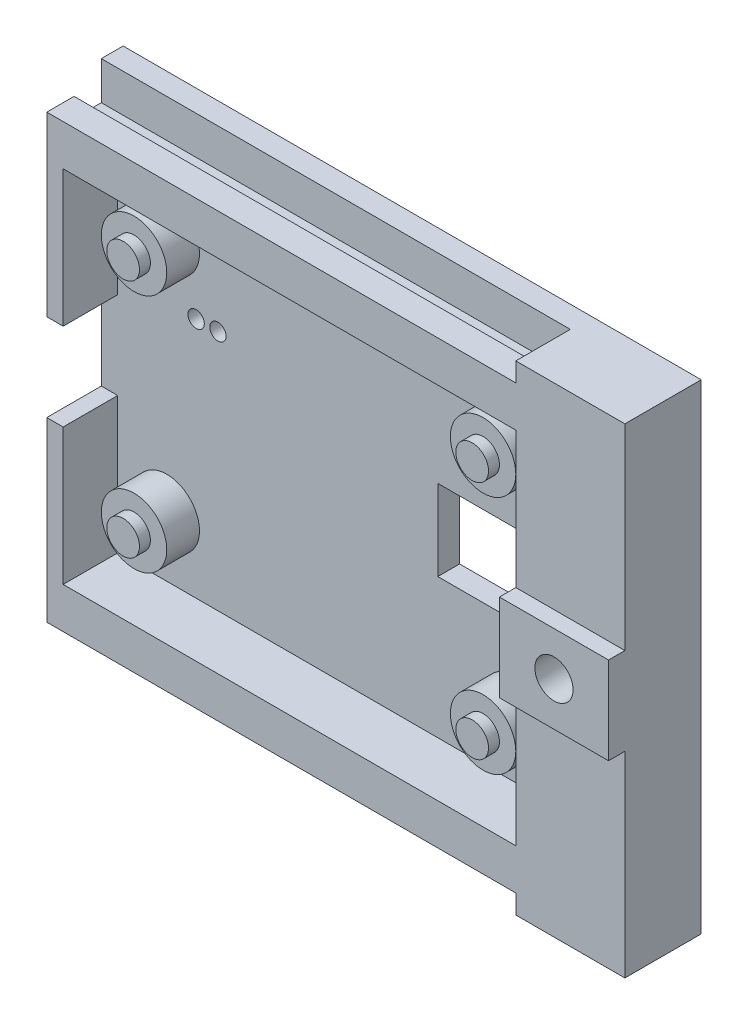
from build123d import *

# Parameters (mm, degrees)
CROQUIS1_W              = 53
CROQUIS1_H              = 44
CROQUIS1_R              = 0.75
CROQUIS1_W_2            = 7.4
CROQUIS1_H_2            = 7.4
SALIENTE_EXTRUIR1_DEPTH = 2
CROQUIS4_R              = 1.5
SALIENTE_EXTRUIR3_DEPTH = 4
CORTAR_EXTRUIR1_REACH   = 40.484
CROQUIS5_R              = 1.75
CROQUIS6_R              = 1.75
CROQUIS6_W              = 41.5
CROQUIS6_H              = 33
SALIENTE_EXTRUIR4_DEPTH = 5
CROQUIS7_W              = 43
CROQUIS7_H              = 1.75
SALIENTE_EXTRUIR5_DEPTH = 2.5
CROQUIS8_W              = 1.5
CROQUIS8_H              = 8
CORTAR_EXTRUIR3_DEPTH   = 5
CROQUIS9_R              = 3.5
CORTAR_EXTRUIR4_DEPTH   = 5
CROQUIS10_R             = 3
SALIENTE_EXTRUIR6_DEPTH = 3
CROQUIS12_W             = 10
CROQUIS12_H             = 8
CROQUIS12_R             = 1.75
SALIENTE_EXTRUIR7_DEPTH = 1.5


with BuildPart() as part:
    # Croquis1 → Saliente-Extruir1 (new body)
    with BuildSketch(Plane.XY):
        with Locations((4.5, 0)):
            Rectangle(CROQUIS1_W, CROQUIS1_H)
        with Locations((-13.3084, 5.6686)):
            Circle(CROQUIS1_R, mode=Mode.SUBTRACT)
        with Locations((-11.3084, 5.6686)):
            Circle(CROQUIS1_R, mode=Mode.SUBTRACT)
        with Locations((12.55, 0)):
            Rectangle(CROQUIS1_W_2, CROQUIS1_H_2, mode=Mode.SUBTRACT)
    extrude(amount=SALIENTE_EXTRUIR1_DEPTH)

    # Croquis4 → Saliente-Extruir3 (add)
    with BuildSketch(Plane.XY.offset(2)):
        with Locations((-16, -11)):
            Circle(CROQUIS4_R)
        with Locations((16, -11)):
            Circle(CROQUIS4_R)
        with Locations((16, 11)):
            Circle(CROQUIS4_R)
        with Locations((-16, 11)):
            Circle(CROQUIS4_R)
    extrude(amount=SALIENTE_EXTRUIR3_DEPTH)

    # Croquis5 → Cortar-Extruir1 (cut, up to next)
    with BuildSketch(Plane(origin=(0, 0, 0), x_dir=(-1, 0, 0), z_dir=(0, 0, -1)), mode=Mode.PRIVATE) as cortar_extruir1_sk1:
        with Locations((-26, 0)):
            Circle(CROQUIS5_R)
    cortar_extruir1_tool1 = extrude(cortar_extruir1_sk1.sketch, amount=-CORTAR_EXTRUIR1_REACH, mode=Mode.PRIVATE) & part.part
    add(cortar_extruir1_tool1.solids().sort_by_distance((26, 0, 0))[0], mode=Mode.SUBTRACT)

    # Croquis6 → Saliente-Extruir4 (add)
    with BuildSketch(Plane.XY.offset(2)):
        Polygon((-22, -18.5), (21, -18.5), (21, -22), (31, -22), (31, 22), (21, 22), (21, 18.5), (-22, 18.5), align=None)
        with Locations(Location((26, 0, 0), (0, 0, 180))):
            Circle(CROQUIS6_R, mode=Mode.SUBTRACT)
        with Locations((0.25, 0)):
            Rectangle(CROQUIS6_W, CROQUIS6_H, mode=Mode.SUBTRACT)
    extrude(amount=SALIENTE_EXTRUIR4_DEPTH)

    # Croquis7 → Saliente-Extruir5 (add)
    with BuildSketch(Plane.XY.offset(7)):
        with Locations((-0.5, 19.375)):
            Rectangle(CROQUIS7_W, CROQUIS7_H)
        with Locations((-0.5, -19.375)):
            Rectangle(CROQUIS7_W, CROQUIS7_H)
    extrude(amount=-SALIENTE_EXTRUIR5_DEPTH)

    # Croquis8 → Cortar-Extruir3 (cut)
    with BuildSketch(Plane.XY.offset(7)):
        with Locations((-21.25, 0)):
            Rectangle(CROQUIS8_W, CROQUIS8_H)
    extrude(amount=-CORTAR_EXTRUIR3_DEPTH, mode=Mode.SUBTRACT)

    # Croquis9 → Cortar-Extruir4 (cut)
    with BuildSketch(Plane(origin=(0, 0, 0), x_dir=(-1, 0, 0), z_dir=(0, 0, -1))):
        with Locations((-26, 0)):
            Circle(CROQUIS9_R)
    extrude(amount=-CORTAR_EXTRUIR4_DEPTH, mode=Mode.SUBTRACT)

    # Croquis10 → Saliente-Extruir6 (add)
    with BuildSketch(Plane.XY.offset(2)):
        with Locations((-16, 11)):
            Circle(CROQUIS10_R)
        with Locations((16, 11)):
            Circle(CROQUIS10_R)
        with Locations((16, -11)):
            Circle(CROQUIS10_R)
        with Locations((-16, -11)):
            Circle(CROQUIS10_R)
    extrude(amount=SALIENTE_EXTRUIR6_DEPTH)

    # Croquis12 → Saliente-Extruir7 (add)
    with BuildSketch(Plane.XY.offset(7)):
        with Locations((26, 0)):
            Rectangle(CROQUIS12_W, CROQUIS12_H)
        with Locations(Location((26, 0, 0), (0, 0, 180))):
            Circle(CROQUIS12_R, mode=Mode.SUBTRACT)
    extrude(amount=SALIENTE_EXTRUIR7_DEPTH)


solid = part.part
